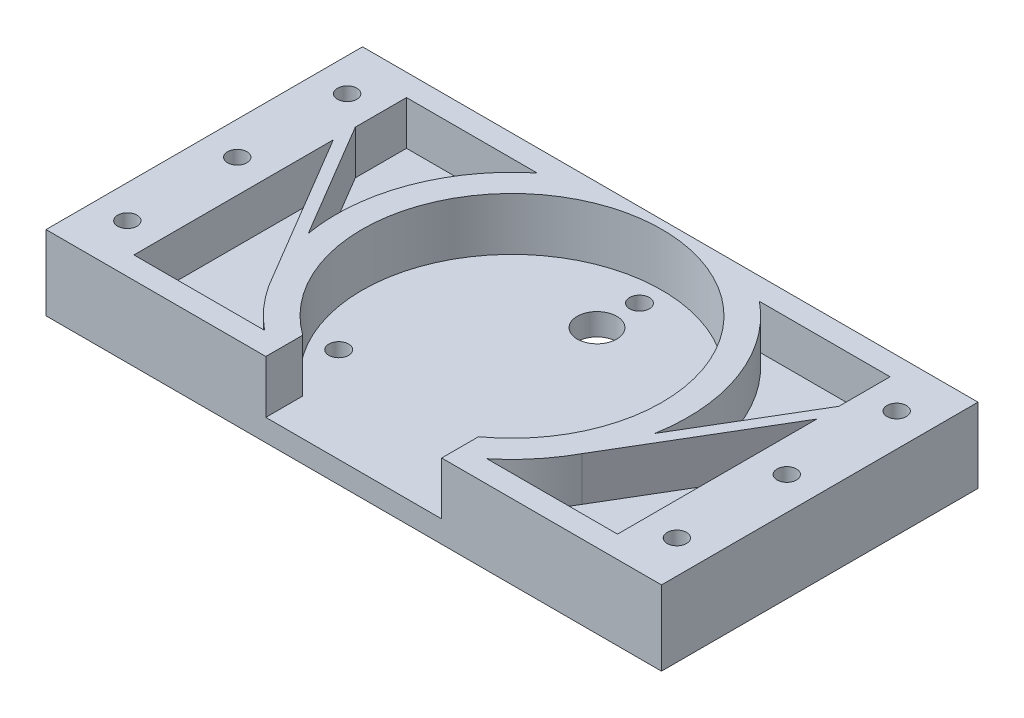
from build123d import *

# Parameters (mm, degrees)
SKETCH1_W           = 140
SKETCH1_H           = 72
BOSS_EXTRUDE1_DEPTH = 17
SKETCH2_R           = 34.1
CUT_EXTRUDE1_DEPTH  = 12
SKETCH3_W           = 40
SKETCH3_H           = 24
CUT_EXTRUDE2_DEPTH  = 10
SKETCH4_R           = 2.2
CUT_EXTRUDE3_DEPTH  = 81.529497701
SKETCH5_R           = 2.25
SKETCH5_R_2         = 4.5
CUT_EXTRUDE4_DEPTH  = 80.62411695
CUT_EXTRUDE5_DEPTH  = 10


with BuildPart() as part:
    # Sketch1 → Boss-Extrude1 (new body)
    with BuildSketch(Plane(origin=(0, 0, 0), x_dir=(1, 0, 0), z_dir=(0, 1, 0))):
        Rectangle(SKETCH1_W, SKETCH1_H)
    extrude(amount=BOSS_EXTRUDE1_DEPTH)

    # Sketch2 → Cut-Extrude1 (cut)
    with BuildSketch(Plane(origin=(0, 17, 0), x_dir=(1, 0, 0), z_dir=(0, 1, 0))):
        with Locations(Location((0, 0, 0), (0, 0, 270))):
            Circle(SKETCH2_R)
    extrude(amount=-CUT_EXTRUDE1_DEPTH, mode=Mode.SUBTRACT)

    # Sketch3 → Cut-Extrude2 (cut)
    with BuildSketch(Plane.XY.offset(36)):
        with Locations((0, 17)):
            Rectangle(SKETCH3_W, SKETCH3_H)
    extrude(amount=-CUT_EXTRUDE2_DEPTH, mode=Mode.SUBTRACT)

    # Sketch4 → Cut-Extrude3 (cut, through all)
    with BuildSketch(Plane(origin=(0, 17, 0), x_dir=(1, 0, 0), z_dir=(0, 1, 0))):
        with Locations(Location((-62.5, 25, 0), (0, 0, 270))):
            Circle(SKETCH4_R)
        with Locations(Location((-62.5, 0, 0), (0, 0, 270))):
            Circle(SKETCH4_R)
        with Locations(Location((-62.5, -25, 0), (0, 0, 270))):
            Circle(SKETCH4_R)
        with Locations(Location((62.5, -25, 0), (0, 0, 90))):
            Circle(SKETCH4_R)
        with Locations(Location((62.5, 0, 0), (0, 0, 90))):
            Circle(SKETCH4_R)
        with Locations(Location((62.5, 25, 0), (0, 0, 90))):
            Circle(SKETCH4_R)
    extrude(amount=-CUT_EXTRUDE3_DEPTH, mode=Mode.SUBTRACT)

    # Sketch5 → Cut-Extrude4 (cut, through all)
    with BuildSketch(Plane(origin=(0, 5, 0), x_dir=(1, 0, 0), z_dir=(0, 1, 0))):
        with Locations(Location((0, 29, 0), (0, 0, 270))):
            Circle(SKETCH5_R)
        with Locations(Location((25.042343364, -14.374611046, 0), (0, 0, 270))):
            Circle(SKETCH5_R)
        with Locations(Location((-25.042343364, -14.374611046, 0), (0, 0, 270))):
            Circle(SKETCH5_R)
        with Locations(Location((0, 19.333592636, 0), (0, 0, 270))):
            Circle(SKETCH5_R_2)
    extrude(amount=-CUT_EXTRUDE4_DEPTH, mode=Mode.SUBTRACT)

    # Sketch6 → Cut-Extrude5 (cut)
    with BuildSketch(Plane(origin=(0, 17, 0), x_dir=(1, 0, 0), z_dir=(0, 1, 0))):
        with BuildLine():
            Line((-55, 31), (-25.27844932, 31))
            ThreePointArc((-25.27844932, 31), (-37.491645865, 13.941896942), (-39.391334679, -6.951456838))
            Line((-39.391334679, -6.951456838), (-55, 19.35498509))
            Line((-55, 19.35498509), (-55, 31))
        make_face()
        with BuildLine():
            Line((-55, -31), (-25.27844932, -31))
            ThreePointArc((-25.27844932, -31), (-30.757821307, -25.5725718), (-35.093761786, -19.194475343))
            Line((-35.093761786, -19.194475343), (-55, 14.35498509))
            Line((-55, 14.35498509), (-55, -31))
        make_face()
        with BuildLine():
            Line((55, -31), (25.27844932, -31))
            ThreePointArc((25.27844932, -31), (30.757821307, -25.5725718), (35.093761786, -19.194475343))
            Line((35.093761786, -19.194475343), (55, 14.35498509))
            Line((55, 14.35498509), (55, -31))
        make_face()
        with BuildLine():
            Line((55, 31), (55, 19.35498509))
            Line((55, 19.35498509), (39.391334679, -6.951456838))
            ThreePointArc((39.391334679, -6.951456838), (37.491645865, 13.941896942), (25.27844932, 31))
            Line((25.27844932, 31), (55, 31))
        make_face()
    extrude(amount=-CUT_EXTRUDE5_DEPTH, mode=Mode.SUBTRACT)


solid = part.part
